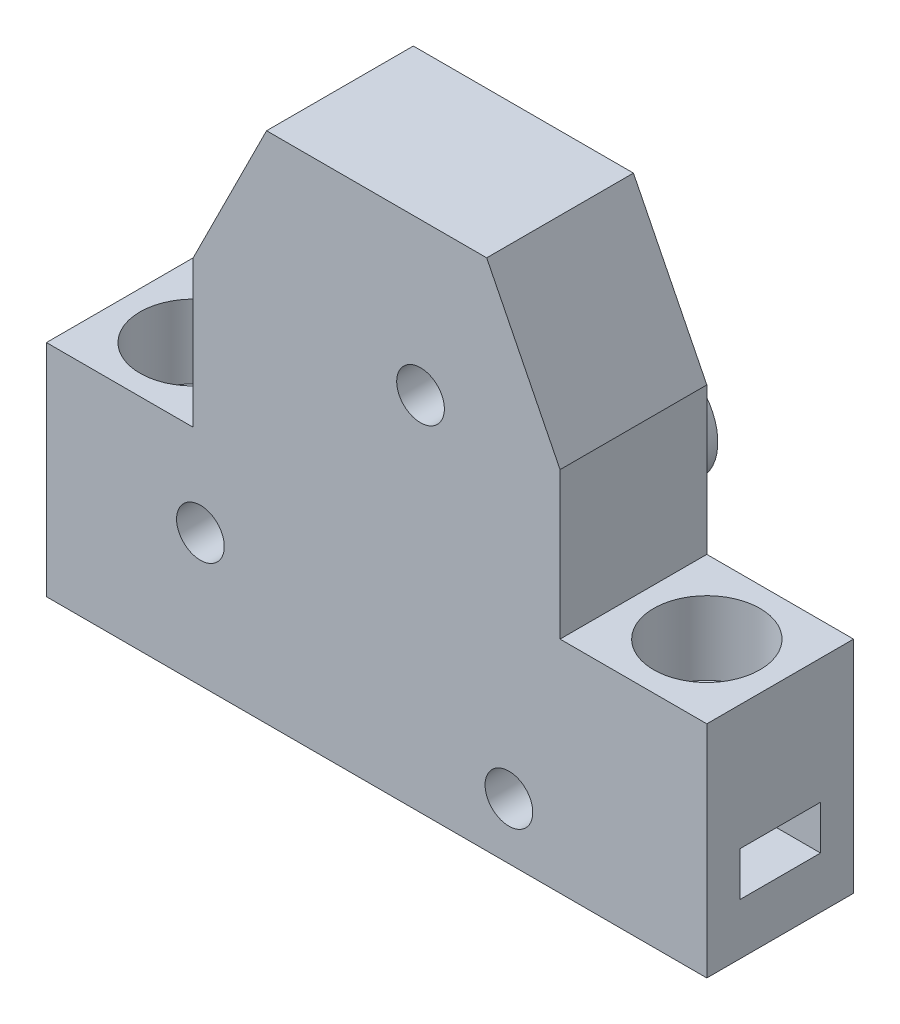
from build123d import *

# Parameters (mm, degrees)
BODY_DEPTH             = 10
SKETCH14_R             = 7.5
BEARING_SUPPORT_DEPTH  = 15
SKETCH15_R             = 7.5
SKETCH15_R_2           = 4.7
BEARING_PLACE_DEPTH    = 4
SKETCH16_R             = 2
MOTOR_SHAFT_HOLE_DEPTH = 3
FILLET1_R              = 6
SKETCH17_R             = 7.25
SPRING_HOLE_DEPTH      = 10
SKETCH18_W             = 11
SKETCH18_H             = 6
NUT_HOLE_DEPTH         = 20
SKETCH19_R             = 3.25
SHAFT_HOLE_DEPTH       = 13
SKETCH20_R             = 3.25
BRAKE_DISK_HOLES_DEPTH = 67.708320321


with BuildPart() as part:
    # Sketch1 → Body (new, symmetric)
    with BuildSketch(Plane.XY):
        Polygon((-25, 25), (-15, 45), (15, 45), (25, 25), (25, 5), (45, 5), (45, -25), (25, -25), (-25, -25), (-45, -25), (-45, 5), (-25, 5), align=None)
    extrude(amount=BODY_DEPTH, both=True)

    # Sketch14 → Bearing_Support (add)
    with BuildSketch(Plane(origin=(0, 0, -10), x_dir=(-1, 0, 0), z_dir=(0, 0, -1))):
        Circle(SKETCH14_R)
    extrude(amount=BEARING_SUPPORT_DEPTH)

    # Sketch15 → Bearing_Place (add)
    with BuildSketch(Plane(origin=(0, 0, -25), x_dir=(-1, 0, 0), z_dir=(0, 0, -1))):
        Circle(SKETCH15_R)
        Circle(SKETCH15_R_2, mode=Mode.SUBTRACT)
    extrude(amount=BEARING_PLACE_DEPTH)

    # Sketch16 → Motor_Shaft_Hole (cut)
    with BuildSketch(Plane(origin=(0, 0, -25), x_dir=(-1, 0, 0), z_dir=(0, 0, -1))):
        Circle(SKETCH16_R)
    extrude(amount=-MOTOR_SHAFT_HOLE_DEPTH, mode=Mode.SUBTRACT)

    # Fillet1
    fillet1_edges = [part.edges().sort_by_distance(p)[0] for p in [
        (7.5, 0, -10),
    ]]
    fillet(fillet1_edges, radius=FILLET1_R)

    # Sketch17 → Spring_Hole (cut)
    with BuildSketch(Plane(origin=(0, 5, 0), x_dir=(1, 0, 0), z_dir=(0, 1, 0))):
        with Locations(Location((-35, 0, 0), (0, 0, 180))):
            Circle(SKETCH17_R)
    spring_hole = extrude(amount=-SPRING_HOLE_DEPTH, mode=Mode.SUBTRACT)

    # Sketch18 → Nut_Hole (cut)
    with BuildSketch(Plane.ZY.offset(45)):
        with Locations((0, -15)):
            Rectangle(SKETCH18_W, SKETCH18_H)
    nut_hole = extrude(amount=-NUT_HOLE_DEPTH, mode=Mode.SUBTRACT)

    # Sketch19 → Shaft_Hole (cut)
    with BuildSketch(Plane(origin=(0, -5, 0), x_dir=(1, 0, 0), z_dir=(0, 1, 0))):
        with Locations(Location((-35, 0, 0), (0, 0, 180))):
            Circle(SKETCH19_R)
    shaft_hole = extrude(amount=-SHAFT_HOLE_DEPTH, mode=Mode.SUBTRACT)

    # Mirror1: Spring_Hole, Nut_Hole, Shaft_Hole across plane
    add(spring_hole.mirror(Plane(origin=(0, 0, 0), x_dir=(0, 0, 1), z_dir=(1, 0, 0))), mode=Mode.SUBTRACT)
    add(nut_hole.mirror(Plane(origin=(0, 0, 0), x_dir=(0, 0, 1), z_dir=(1, 0, 0))), mode=Mode.SUBTRACT)
    add(shaft_hole.mirror(Plane(origin=(0, 0, 0), x_dir=(0, 0, 1), z_dir=(1, 0, 0))), mode=Mode.SUBTRACT)

    # Sketch20 → Brake_Disk_Holes (cut, through all)
    with BuildSketch(Plane(origin=(0, 0, -10), x_dir=(-1, 0, 0), z_dir=(0, 0, -1))):
        with Locations((-5.98239088, 24.273668848)):
            Circle(SKETCH20_R)
        with Locations((24.012809306, -6.955931947)):
            Circle(SKETCH20_R)
        with Locations((-18.030418426, -17.317736902)):
            Circle(SKETCH20_R)
    extrude(amount=-BRAKE_DISK_HOLES_DEPTH, mode=Mode.SUBTRACT)


solid = part.part
